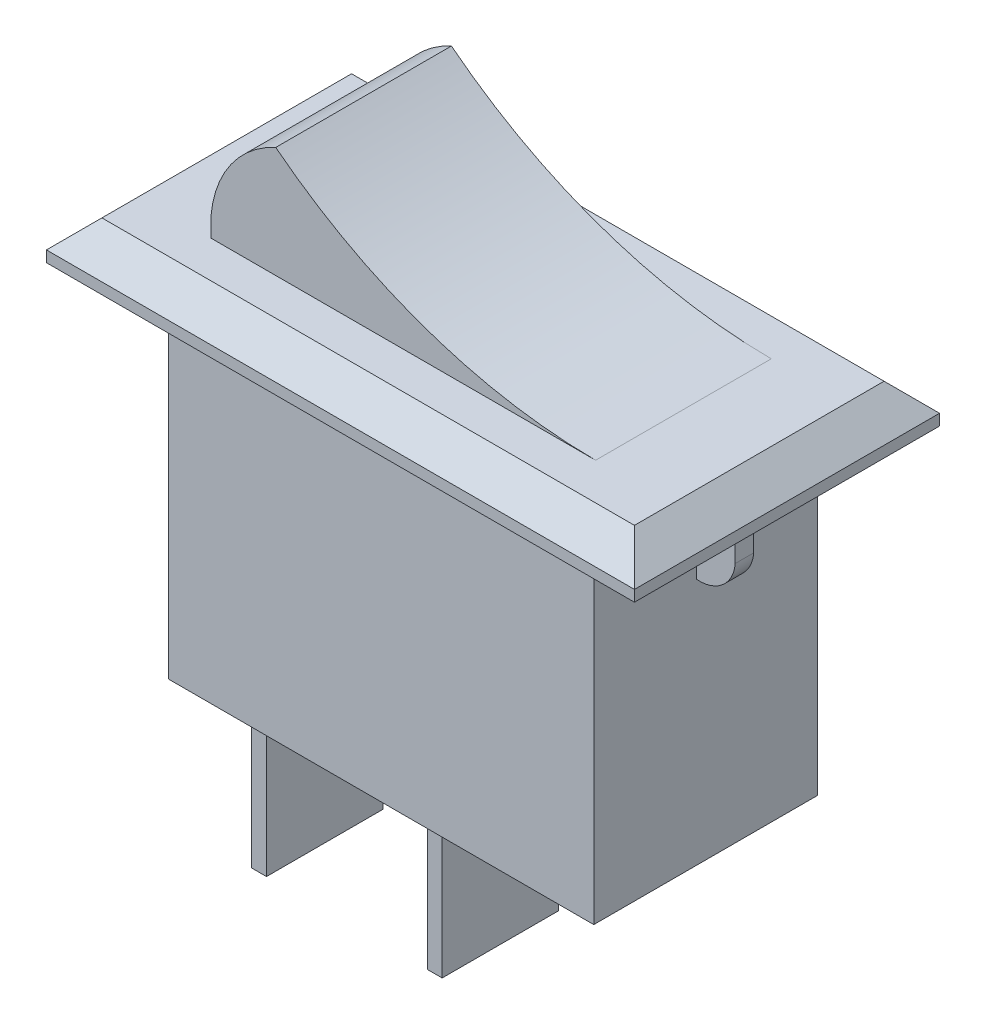
from build123d import *

# Parameters (mm, degrees)
SKETCH1_W           = 23
SKETCH1_H           = 12.1
BOSS_EXTRUDE1_DEPTH = 18.4
SKETCH2_W           = 0.8
SKETCH2_H           = 6.3
BOSS_EXTRUDE2_DEPTH = 9.5
SKETCH3_W           = 31.8
SKETCH3_H           = 16.5
BOSS_EXTRUDE3_DEPTH = 2.1
CHAMFER1_SIZE       = 1.5
SKETCH4_W           = 1
SKETCH4_H           = 5
BOSS_EXTRUDE4_DEPTH = 2.1
CUT_EXTRUDE1_DEPTH  = 1
SKETCH7_W           = 21
SKETCH7_H           = 9.5
BOSS_EXTRUDE5_DEPTH = 6
CUT_EXTRUDE3_DEPTH  = 9.5


with BuildPart() as part:
    # Sketch1 → Boss-Extrude1 (new body)
    with BuildSketch(Plane(origin=(0, 0, 0), x_dir=(1, 0, 0), z_dir=(0, 1, 0))):
        with Locations((11.5, 6.05)):
            Rectangle(SKETCH1_W, SKETCH1_H)
    extrude(amount=BOSS_EXTRUDE1_DEPTH)

    # Sketch2 → Boss-Extrude2 (add)
    with BuildSketch(Plane.XZ):
        with Locations((2, -6.05)):
            Rectangle(SKETCH2_W, SKETCH2_H)
        with Locations((11.5, -6.05)):
            Rectangle(SKETCH2_W, SKETCH2_H)
    extrude(amount=BOSS_EXTRUDE2_DEPTH)

    # Sketch3 → Boss-Extrude3 (add)
    with BuildSketch(Plane(origin=(0, 18.4, 0), x_dir=(1, 0, 0), z_dir=(0, 1, 0))):
        with Locations((11.5, 6.05)):
            Rectangle(SKETCH3_W, SKETCH3_H)
    extrude(amount=BOSS_EXTRUDE3_DEPTH)

    # Chamfer1
    chamfer1_edges = [part.edges().sort_by_distance(p)[0] for p in [
        (-4.4, 20.5, -6.05),
        (11.5, 20.5, 2.2),
        (27.4, 20.5, -6.05),
        (11.5, 20.5, -14.3),
    ]]
    chamfer(chamfer1_edges, length=CHAMFER1_SIZE)

    # Sketch4 → Boss-Extrude4 (add)
    with BuildSketch(Plane.ZY):
        with Locations((-6.05, 15.9)):
            Rectangle(SKETCH4_W, SKETCH4_H)
    boss_extrude4 = extrude(amount=BOSS_EXTRUDE4_DEPTH)

    # Sketch5 → Cut-Extrude1 (cut)
    with BuildSketch(Plane.XY.offset(-5.55)):
        with BuildLine():
            ThreePointArc((-0.312308302, 13.4), (-1.535088668, 13.964911332), (-2.1, 15.187691698))
            Line((-2.1, 15.187691698), (-2.1, 13.4))
            Line((-2.1, 13.4), (-0.312308302, 13.4))
        make_face()
    cut_extrude1 = extrude(amount=-CUT_EXTRUDE1_DEPTH, mode=Mode.SUBTRACT)

    # Mirror2: Boss-Extrude4 across plane
    add(boss_extrude4.mirror(Plane.ZY.offset(-11.5)))

    # Mirror3: Cut-Extrude1 across plane
    add(cut_extrude1.mirror(Plane.ZY.offset(-11.5)), mode=Mode.SUBTRACT)

    # Sketch7 → Boss-Extrude5 (add)
    with BuildSketch(Plane(origin=(0, 20.5, 0), x_dir=(1, 0, 0), z_dir=(0, 1, 0))):
        with Locations((11.5, 6.05)):
            Rectangle(SKETCH7_W, SKETCH7_H)
    extrude(amount=BOSS_EXTRUDE5_DEPTH)

    # Sketch8 → Cut-Extrude3 (cut)
    with BuildSketch(Plane.XY.offset(-1.3)):
        with BuildLine():
            ThreePointArc((1, 21.544517728), (2.080144811, 24.495369861), (4.5, 26.5))
            Line((4.5, 26.5), (1, 26.5))
            Line((1, 26.5), (1, 21.544517728))
        make_face()
        with BuildLine():
            Line((1, 20.5), (1, 21.544517728))
            ThreePointArc((1, 21.544517728), (0.977304154, 21.022258864), (1, 20.5))
        make_face()
        with BuildLine():
            Line((22, 26.5), (4.5, 26.5))
            ThreePointArc((4.5, 26.5), (12.74453051, 22.025713988), (22, 20.5))
            Line((22, 20.5), (22, 26.5))
        make_face()
    extrude(amount=-CUT_EXTRUDE3_DEPTH, mode=Mode.SUBTRACT)


solid = part.part
